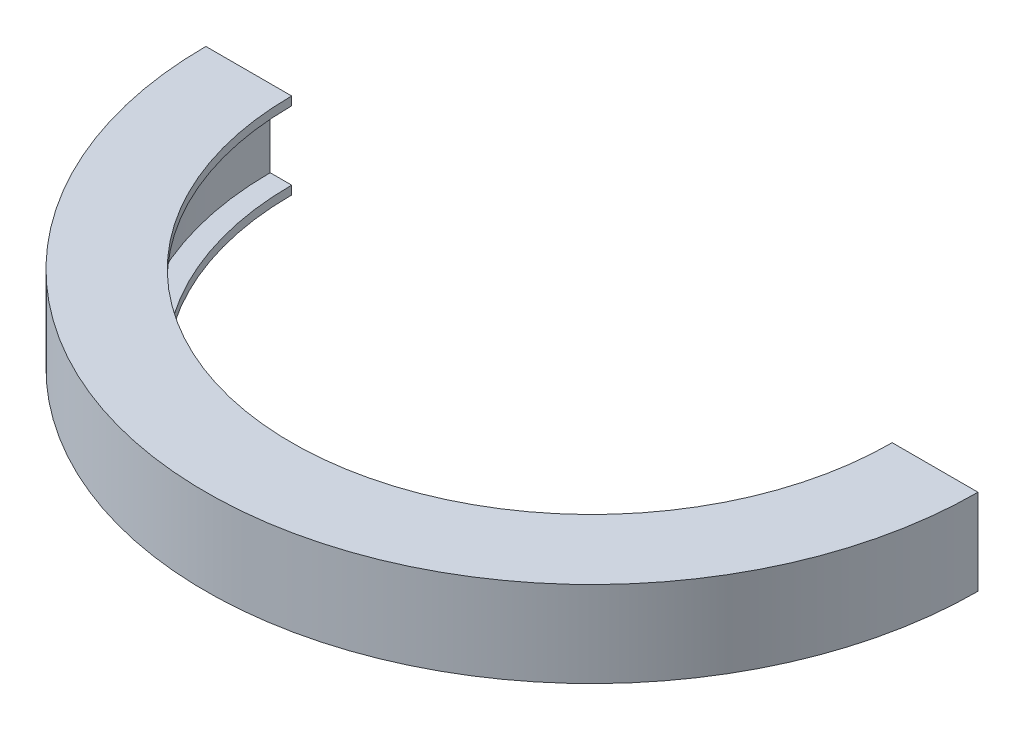
from build123d import *

# Parameters (mm, degrees)
BOSS_EXTRUDE1_DEPTH = 10
SKETCH2_W           = 5
SKETCH2_H           = 16


with BuildPart() as part:
    # Sketch1 → Boss-Extrude1 (new, symmetric)
    with BuildSketch(Plane(origin=(0, 0, 0), x_dir=(1, 0, 0), z_dir=(0, 1, 0))):
        with BuildLine():
            Line((-70, 0), (-90, 0))
            ThreePointArc((-90, 0), (0, -90), (90, 0))
            Line((90, 0), (70, 0))
            ThreePointArc((70, 0), (0, -70), (-70, 0))
        make_face()
    extrude(amount=BOSS_EXTRUDE1_DEPTH, both=True)

    # Sketch2 → Cut-Revolve1 (revolve, cut)
    with BuildSketch(Plane(origin=(0, 0, 0), x_dir=(-1, 0, 0), z_dir=(0, 0, -1))):
        with Locations((72.5, 0)):
            Rectangle(SKETCH2_W, SKETCH2_H)
    revolve(axis=Axis((0, 5.63590195, 0), (0, -1, 0)), mode=Mode.SUBTRACT)


solid = part.part
